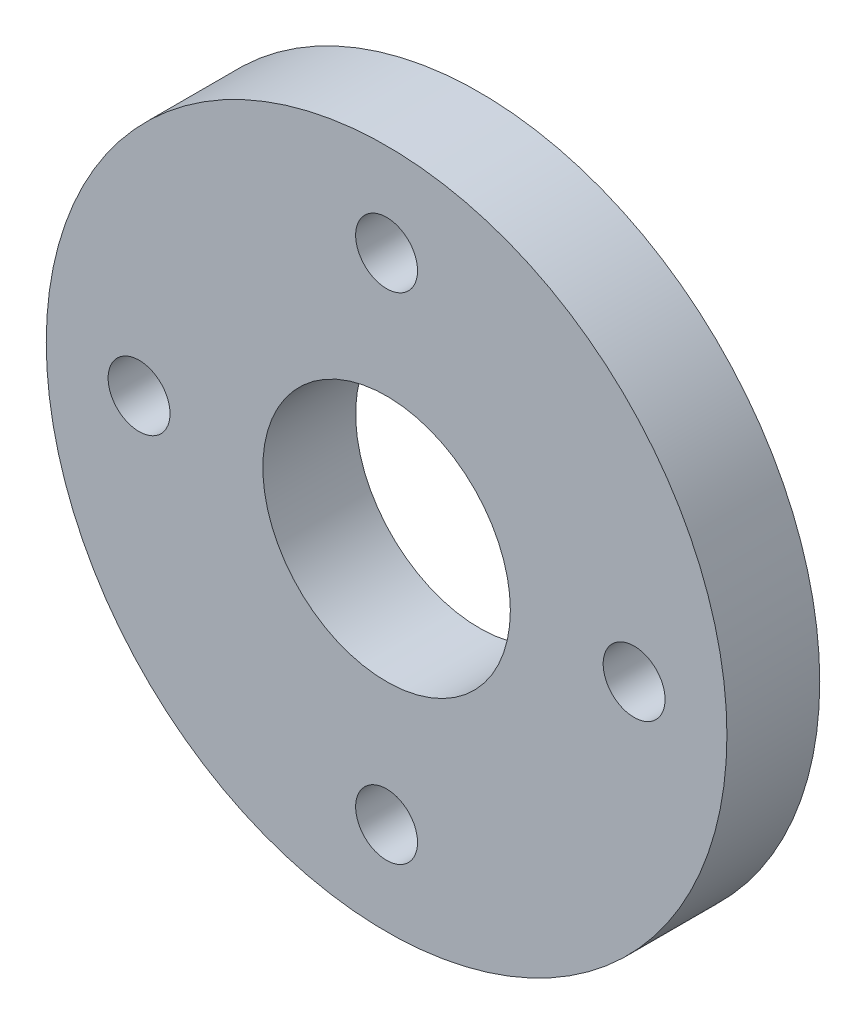
from build123d import *

# Parameters (mm, degrees)
ESQUISSE1_R             = 11
BOSS_EXTRU_1_DEPTH      = 3
ESQUISSE2_R             = 4
ESQUISSE2_R_2           = 1
ENL_V_MAT_EXTRU_1_DEPTH = 3


with BuildPart() as part:
    # Esquisse1 → Boss.-Extru.1 (new body)
    with BuildSketch(Plane.XY):
        Circle(ESQUISSE1_R)
    extrude(amount=BOSS_EXTRU_1_DEPTH)

    # Esquisse2 → Enlèv. mat.-Extru.1 (cut)
    with BuildSketch(Plane.XY.offset(3)):
        Circle(ESQUISSE2_R)
        with Locations((0, 8)):
            Circle(ESQUISSE2_R_2)
        with Locations((0, -8)):
            Circle(ESQUISSE2_R_2)
        with Locations((8, 0)):
            Circle(ESQUISSE2_R_2)
        with Locations((-8, 0)):
            Circle(ESQUISSE2_R_2)
    extrude(amount=-ENL_V_MAT_EXTRU_1_DEPTH, mode=Mode.SUBTRACT)


solid = part.part
